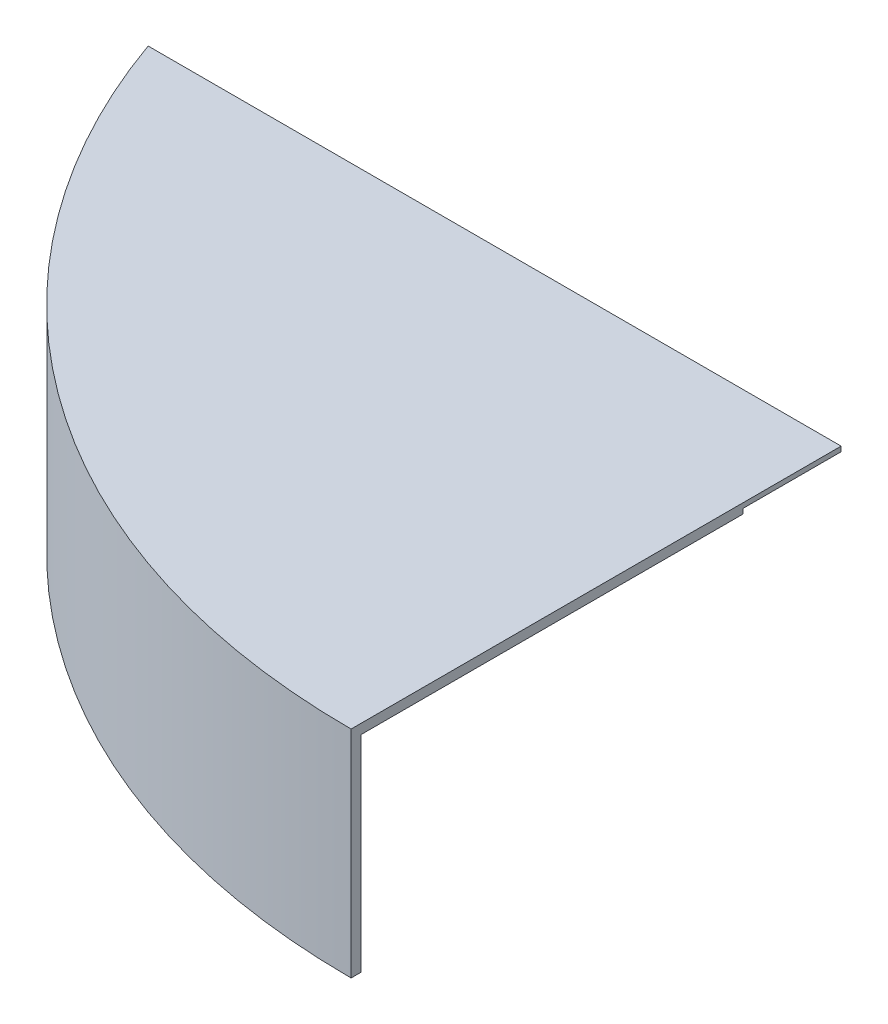
from build123d import *

# Parameters (mm, degrees)
BOSS_EXTRUDE1_DEPTH = 44
SHELL1_T            = -2
CUT_EXTRUDE1_DEPTH  = 1


with BuildPart() as part:
    # Sketch1 → Boss-Extrude1 (new body)
    with BuildSketch(Plane(origin=(0, 0, 0), x_dir=(1, 0, 0), z_dir=(0, 1, 0))):
        with BuildLine():
            Line((0, -50), (0, -150))
            ThreePointArc((0, -150), (-86.602540378, -122.474487139), (-141.421356237, -50))
            Line((-141.421356237, -50), (0, -50))
        make_face()
    extrude(amount=BOSS_EXTRUDE1_DEPTH)

    # Shell1
    shell1_openings = [part.faces().sort_by_distance(p)[0] for p in [
        (-56.564232989, 0, 91.421606215),
        (-70.710678119, 22, 50),
        (0, 22, 100),
    ]]
    offset(amount=SHELL1_T, openings=shell1_openings, kind=Kind.INTERSECTION)

    # Sketch3 → Cut-Extrude1 (cut)
    with BuildSketch(Plane.XZ.offset(-42)):
        with BuildLine():
            Line((-139.298241195, 50), (0, 50))
            Line((0, 50), (0, 70))
            Line((0, 70), (-130.399386502, 70))
            ThreePointArc((-130.399386502, 70), (-135.219091094, 60.16475217), (-139.298241195, 50))
        make_face()
    extrude(amount=-CUT_EXTRUDE1_DEPTH, mode=Mode.SUBTRACT)


solid = part.part
